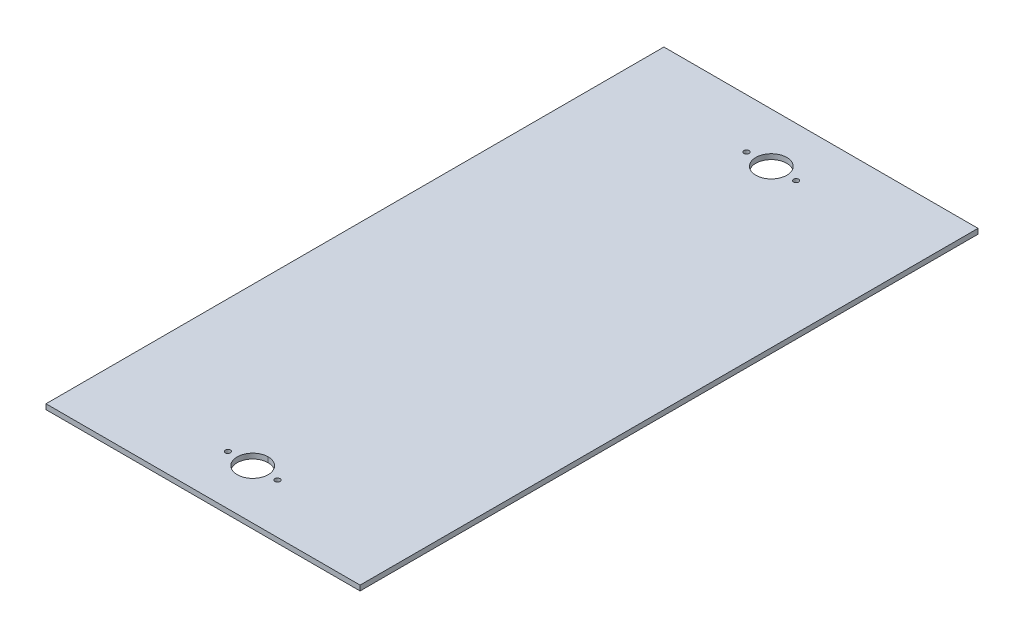
from build123d import *

# Parameters (mm, degrees)
SKETCH1_W           = 183.7944
SKETCH1_H           = 285.3944
BOSS_EXTRUDE1_DEPTH = 2.9972
SKETCH2_R           = 1.5
BOSS_EXTRUDE2_DEPTH = 2.9972


with BuildPart() as part:
    # Sketch1 → Boss-Extrude1 (new body)
    with BuildSketch(Plane(origin=(0, 0, 0), x_dir=(1, 0, 0), z_dir=(0, 1, 0))):
        Rectangle(SKETCH1_W, SKETCH1_H)
    extrude(amount=BOSS_EXTRUDE1_DEPTH)

    # Sketch2 → Boss-Extrude2 (add)
    # profile 1 of 2: a face of its own
    with BuildSketch(Plane(origin=(0, 2.9972, 0), x_dir=(1, 0, 0), z_dir=(0, 1, 0))):
        with BuildLine():
            Line((-0.300873728, -142.6972), (-91.8972, -142.6972))
            Line((-91.8972, -142.6972), (-91.8972, -180.7972))
            Line((-91.8972, -180.7972), (91.8972, -180.7972))
            Line((91.8972, -180.7972), (91.8972, -142.6972))
            Line((91.8972, -142.6972), (0.300873728, -142.6972))
            ThreePointArc((0.300873728, -142.6972), (0, -160.8022), (-0.300873728, -142.6972))
        make_face()
        with Locations(Location((-14.505, -151.7472, 0), (0, 0, 270))):
            Circle(SKETCH2_R, mode=Mode.SUBTRACT)
        with Locations(Location((14.505, -151.7472, 0), (0, 0, 270))):
            Circle(SKETCH2_R, mode=Mode.SUBTRACT)
    # profile 2 of 2: a face of its own
    with BuildSketch(Plane(origin=(0, 2.9972, 0), x_dir=(1, 0, 0), z_dir=(0, 1, 0))):
        with BuildLine():
            Line((0.300873728, 142.6972), (91.8972, 142.6972))
            Line((91.8972, 142.6972), (91.8972, 180.7972))
            Line((91.8972, 180.7972), (-91.8972, 180.7972))
            Line((-91.8972, 180.7972), (-91.8972, 142.6972))
            Line((-91.8972, 142.6972), (-0.300873728, 142.6972))
            ThreePointArc((-0.300873728, 142.6972), (0, 160.8022), (0.300873728, 142.6972))
        make_face()
        with Locations(Location((-14.505, 151.7472, 0), (0, 0, 270))):
            Circle(SKETCH2_R, mode=Mode.SUBTRACT)
        with Locations(Location((14.505, 151.7472, 0), (0, 0, 270))):
            Circle(SKETCH2_R, mode=Mode.SUBTRACT)
    extrude(amount=-BOSS_EXTRUDE2_DEPTH)


solid = part.part
